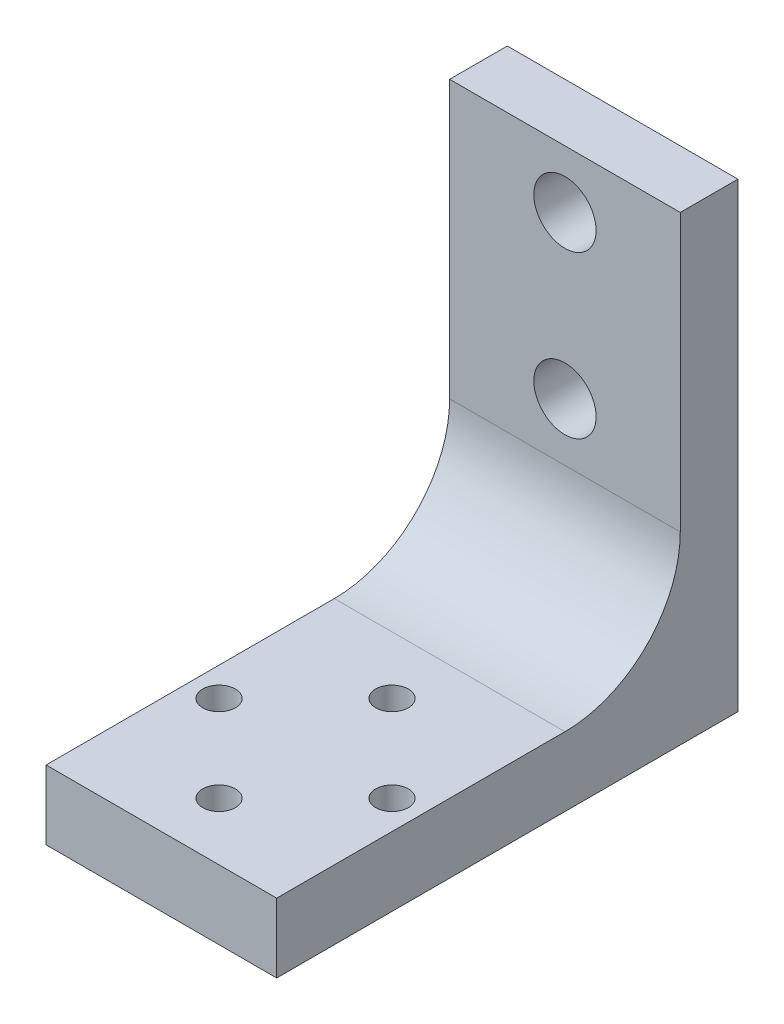
from build123d import *

# Parameters (mm, degrees)
SKETCH1_W           = 25.4
SKETCH1_H           = 50.8
BOSS_EXTRUDE1_DEPTH = 6.35
SKETCH2_W           = 44.45
SKETCH2_H           = 7.62
BOSS_EXTRUDE2_DEPTH = 25.4
FILLET1_R           = 12.7
SKETCH3_R           = 3.429
CUT_EXTRUDE1_DEPTH  = 6.35
SKETCH4_R           = 1.8
CUT_EXTRUDE2_DEPTH  = 7.62


with BuildPart() as part:
    # Sketch1 → Boss-Extrude1 (new body)
    with BuildSketch(Plane.XY):
        with Locations((12.7, 25.4)):
            Rectangle(SKETCH1_W, SKETCH1_H)
    extrude(amount=BOSS_EXTRUDE1_DEPTH)

    # Sketch2 → Boss-Extrude2 (add)
    with BuildSketch(Plane(origin=(25.4, 0, 0), x_dir=(0, 0, -1), z_dir=(1, 0, 0))):
        with Locations((-28.575, 3.81)):
            Rectangle(SKETCH2_W, SKETCH2_H)
    extrude(amount=-BOSS_EXTRUDE2_DEPTH)

    # Fillet1
    fillet1_edges = [part.edges().sort_by_distance(p)[0] for p in [
        (12.7, 7.62, 6.35),
    ]]
    fillet(fillet1_edges, radius=FILLET1_R)

    # Sketch3 → Cut-Extrude1 (cut)
    with BuildSketch(Plane.XY.offset(6.35)):
        with Locations((12.7, 44.45)):
            Circle(SKETCH3_R)
        with Locations((12.7, 26.67)):
            Circle(SKETCH3_R)
    extrude(amount=-CUT_EXTRUDE1_DEPTH, mode=Mode.SUBTRACT)

    # Sketch4 → Cut-Extrude2 (cut)
    with BuildSketch(Plane(origin=(0, 7.62, 0), x_dir=(1, 0, 0), z_dir=(0, 1, 0))):
        with Locations(Location((12.7, -25.4, 0), (0, 0, 270))):
            Circle(SKETCH4_R)
        with Locations(Location((22.225, -34.925, 0), (0, 0, 270))):
            Circle(SKETCH4_R)
        with Locations(Location((12.7, -44.45, 0), (0, 0, 270))):
            Circle(SKETCH4_R)
        with Locations(Location((3.175, -34.925, 0), (0, 0, 270))):
            Circle(SKETCH4_R)
    extrude(amount=-CUT_EXTRUDE2_DEPTH, mode=Mode.SUBTRACT)


solid = part.part
